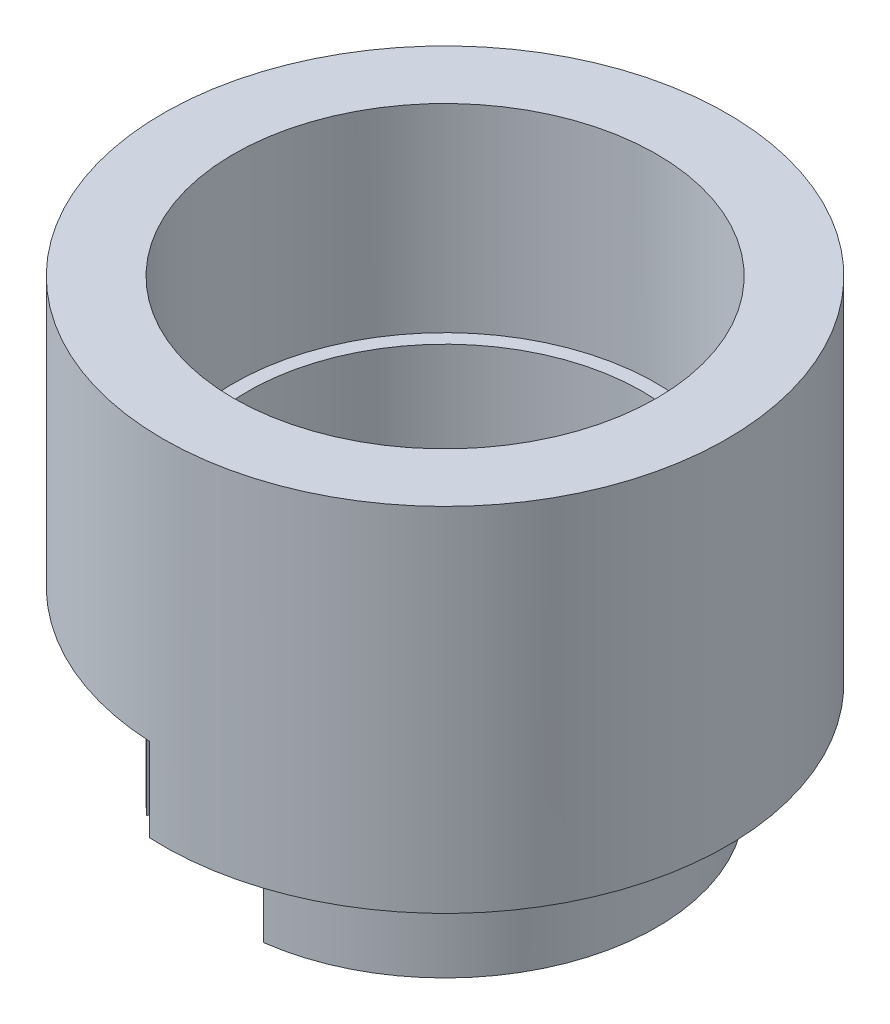
from build123d import *

# Parameters (mm, degrees)
ESBO_O1_R                     = 40
ESBO_O1_R_2                   = 30
RESSALTO_EXTRUS_O1_DEPTH      = 50
ESBO_O2_R                     = 1.5
CORTE_EXTRUS_O1_DEPTH         = 10
CORTE_EXTRUS_O2_DEPTH         = 11.84997677
RESSALTO_EXTRUS_O2_DEPTH      = 26.84997677
RESSALTO_EXTRUS_O2_DEPTH_BACK = 10


with BuildPart() as part:
    # Esboço1 → Ressalto-extrusão1 (new body)
    with BuildSketch(Plane(origin=(0, 0, 0), x_dir=(1, 0, 0), z_dir=(0, 1, 0))):
        with Locations(Location((0, 0, 0), (0, 0, 270))):
            Circle(ESBO_O1_R)
        with Locations(Location((0, 0, 0), (0, 0, 270))):
            Circle(ESBO_O1_R_2, mode=Mode.SUBTRACT)
    extrude(amount=RESSALTO_EXTRUS_O1_DEPTH)

    # Esboço2 → Corte-extrusão1 (cut)
    with BuildSketch(Plane(origin=(0, 0, 0), x_dir=(-1, 0, 0), z_dir=(0, -1, 0))):
        with Locations(Location((-21.160269083, -29.124611797, 0), (0, 0, 90))):
            Circle(ESBO_O2_R)
        with Locations(Location((-34.238034587, -11.124611797, 0), (0, 0, 90))):
            Circle(ESBO_O2_R)
        with Locations(Location((-34.238034587, 11.124611797, 0), (0, 0, 90))):
            Circle(ESBO_O2_R)
        with Locations(Location((21.160269083, 29.124611797, 0), (0, 0, 90))):
            Circle(ESBO_O2_R)
        with Locations(Location((34.238034587, 11.124611797, 0), (0, 0, 90))):
            Circle(ESBO_O2_R)
        with Locations(Location((34.238034587, -11.124611797, 0), (0, 0, 90))):
            Circle(ESBO_O2_R)
    extrude(amount=-CORTE_EXTRUS_O1_DEPTH, mode=Mode.SUBTRACT)

    # Esboço3 → Corte-extrusão2 (cut)
    with BuildSketch(Plane(origin=(0, 0, 0), x_dir=(-1, 0, 0), z_dir=(0, -1, 0))):
        with BuildLine():
            ThreePointArc((30.293924668, -13.087327008), (31.253408489, 10.593604572), (16.092357529, 28.81034587))
            Line((16.092357529, 28.81034587), (19.505887914, 34.921631358))
            ThreePointArc((19.505887914, 34.921631358), (8.030354378, 39.185627576), (-4.197370073, 39.779166463))
            Line((-4.197370073, 39.779166463), (-3.148027555, 29.834374847))
            ThreePointArc((-3.148027555, 29.834374847), (29.911212101, 2.306380417), (1.462902849, -29.964310692))
            Line((1.462902849, -29.964310692), (1.950537132, -39.952414256))
            ThreePointArc((1.950537132, -39.952414256), (22.185986252, -33.283359416), (36.126859334, -17.171197823))
            Line((36.126859334, -17.171197823), (30.293924668, -13.087327008))
        make_face()
    extrude(amount=-CORTE_EXTRUS_O2_DEPTH, mode=Mode.SUBTRACT)

    # Esboço4 → Ressalto-extrusão2 (add, two sides: drawn at the far end of the back side and taken through both)
    with BuildSketch(Plane(origin=(0, 11.84997677, 0), x_dir=(-1, 0, 0), z_dir=(0, -1, 0)).offset(-RESSALTO_EXTRUS_O2_DEPTH_BACK)):
        with BuildLine():
            Line((-4.008838629, -29.730947056), (-4.700362463, -27.602655537))
            ThreePointArc((-4.700362463, -27.602655537), (-8.119302432, 26.79695744), (19.230258499, -20.351834268))
            Line((19.230258499, -20.351834268), (19.909240802, -22.441526924))
            ThreePointArc((19.909240802, -22.441526924), (-8.745833796, 28.696870757), (-4.008838629, -29.730947056))
        make_face()
    extrude(amount=RESSALTO_EXTRUS_O2_DEPTH + RESSALTO_EXTRUS_O2_DEPTH_BACK)


solid = part.part
